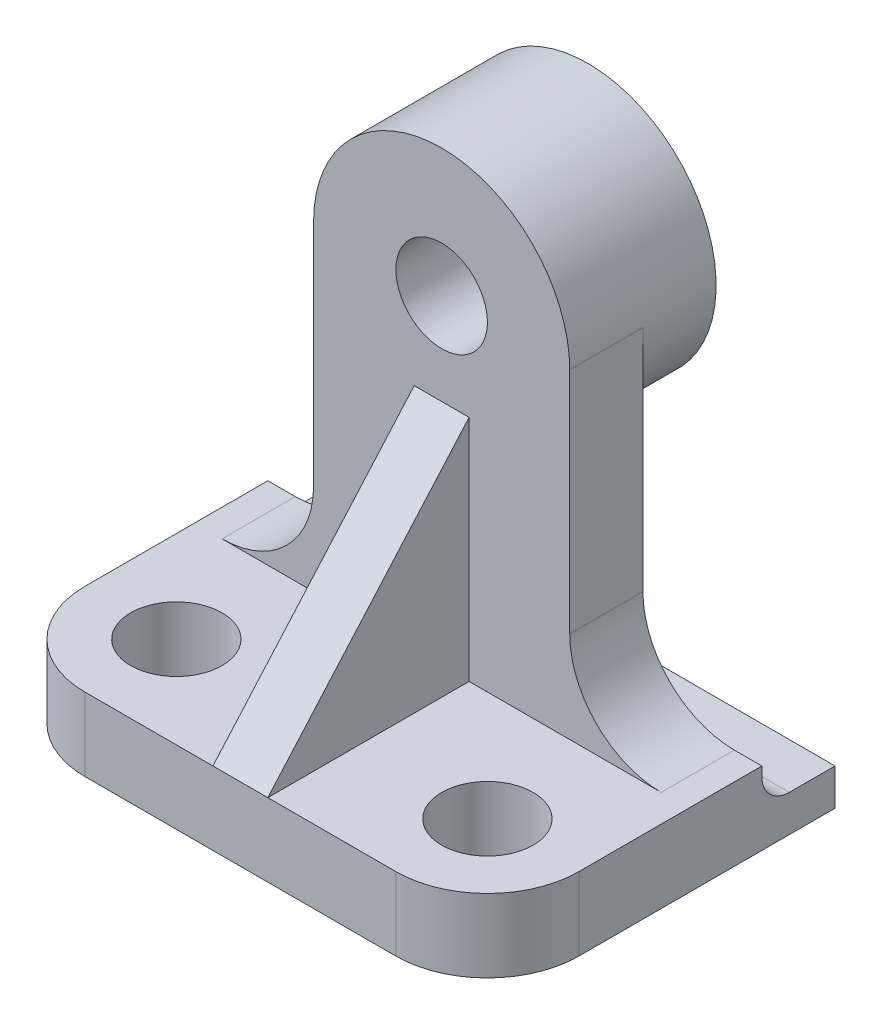
from build123d import *

# Parameters (mm, degrees)
BOSS_EXTRUDE1_DEPTH = 54
FILLET1_R           = 10
SKETCH2_R           = 5
CUT_EXTRUDE1_DEPTH  = 67.513156593
BOSS_EXTRUDE2_DEPTH = 8
FILLET2_R           = 10
BOSS_EXTRUDE3_START = 8
SKETCH4_R           = 14
BOSS_EXTRUDE3_DEPTH = 8
SKETCH5_R           = 5
CUT_EXTRUDE2_DEPTH  = 88.229582138
RIB1_REACH          = 75.634
SKETCH6_WALL_W      = 182.57011395
SKETCH6_WALL_H      = 6


with BuildPart() as part:
    # Sketch1 → Boss-Extrude1 (new body)
    with BuildSketch(Plane(origin=(0, 0, 0), x_dir=(0, 0, -1), z_dir=(1, 0, 0))):
        with BuildLine():
            Line((30, 8), (30, 7))
            ThreePointArc((30, 7), (30.878679656, 4.878679656), (33, 4))
            Line((33, 4), (38, 4))
            Line((38, 4), (38, 0))
            Line((38, 0), (0, 0))
            Line((0, 0), (0, 8))
            Line((0, 8), (30, 8))
        make_face()
    extrude(amount=-BOSS_EXTRUDE1_DEPTH)

    # Fillet1
    fillet1_edges = [part.edges().sort_by_distance(p)[0] for p in [
        (0, 4, 0),
        (-54, 4, 0),
    ]]
    fillet(fillet1_edges, radius=FILLET1_R)

    # Sketch2 → Cut-Extrude1 (cut, through all)
    with BuildSketch(Plane(origin=(0, 8, 0), x_dir=(1, 0, 0), z_dir=(0, 1, 0))):
        with Locations(Location((-44, 10, 0), (0, 0, 270))):
            Circle(SKETCH2_R)
        with Locations(Location((-10, 10, 0), (0, 0, 270))):
            Circle(SKETCH2_R)
    extrude(amount=-CUT_EXTRUDE1_DEPTH, mode=Mode.SUBTRACT)

    # Sketch3 → Boss-Extrude2 (add)
    with BuildSketch(Plane(origin=(0, 0, -30), x_dir=(-1, 0, 0), z_dir=(0, 0, -1))):
        with BuildLine():
            Line((13, 8), (41, 8))
            Line((41, 8), (41, 43))
            ThreePointArc((41, 43), (27, 57), (13, 43))
            Line((13, 43), (13, 8))
        make_face()
    extrude(amount=-BOSS_EXTRUDE2_DEPTH)

    # Fillet2
    fillet2_edges = [part.edges().sort_by_distance(p)[0] for p in [
        (-41, 8, -26),
        (-13, 8, -26),
    ]]
    fillet(fillet2_edges, radius=FILLET2_R)

    # Sketch4 → Boss-Extrude3 (add)
    with BuildSketch(Plane(origin=(0, 0, -30), x_dir=(-1, 0, 0), z_dir=(0, 0, -1)).offset(BOSS_EXTRUDE3_START)):
        with Locations((27, 43)):
            Circle(SKETCH4_R)
    extrude(amount=-BOSS_EXTRUDE3_DEPTH)

    # Sketch5 → Cut-Extrude2 (cut, through all)
    with BuildSketch(Plane(origin=(0, 0, -38), x_dir=(-1, 0, 0), z_dir=(0, 0, -1))):
        with Locations((27, 43)):
            Circle(SKETCH5_R)
    extrude(amount=-CUT_EXTRUDE2_DEPTH, mode=Mode.SUBTRACT)

    # Sketch6 wall → Rib1 (add, up to next)
    with BuildSketch(Plane(origin=(-27, 20.5, -11), x_dir=(0, 0.750713516923, -0.660627894892), z_dir=(0, 0.660627894892, 0.750713516923)), mode=Mode.PRIVATE) as rib1_sk1:
        Rectangle(SKETCH6_WALL_W, SKETCH6_WALL_H)
    rib1_tool1 = extrude(rib1_sk1.sketch, amount=-RIB1_REACH, mode=Mode.PRIVATE) - part.part
    add(rib1_tool1.solids().sort_by_distance((-27, 20.5, -11))[0])


solid = part.part
